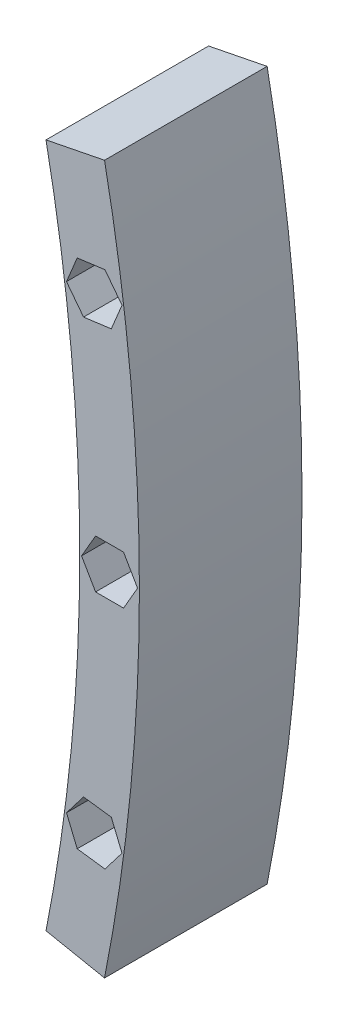
from build123d import *

# Parameters (mm, degrees)
BOSS_EXTRUDE1_DEPTH = 21.8


with BuildPart() as part:
    # Sketch1 → Boss-Extrude1 (new body)
    with BuildSketch(Plane.XY):
        with BuildLine():
            Line((239.323919844, -47.477038572), (231.477637601, -45.916315996))
            ThreePointArc((231.477637601, -45.916315996), (236, 0), (231.477637601, 45.916315996))
            Line((231.477637601, 45.916315996), (239.323919844, 47.477038572))
            ThreePointArc((239.323919844, 47.477038572), (244, 0), (239.323919844, -47.477038572))
        make_face()
        Polygon((236.510641242, 27.859172504), (234.226095505, 30.836450473), (235.662220993, 34.303564103), (239.382892217, 34.793399762), (241.667437954, 31.816121792), (240.231312467, 28.349008163), align=None, mode=Mode.SUBTRACT)
        Polygon((241.876388375, -3.25), (243.75277675, 0), (241.876388375, 3.25), (238.123611625, 3.25), (236.24722325, 0), (238.123611625, -3.25), align=None, mode=Mode.SUBTRACT)
        Polygon((235.662220993, -34.303564103), (239.382892217, -34.793399762), (241.667437954, -31.816121792), (240.231312467, -28.349008163), (236.510641242, -27.859172504), (234.226095505, -30.836450473), align=None, mode=Mode.SUBTRACT)
    extrude(amount=BOSS_EXTRUDE1_DEPTH)


solid = part.part
